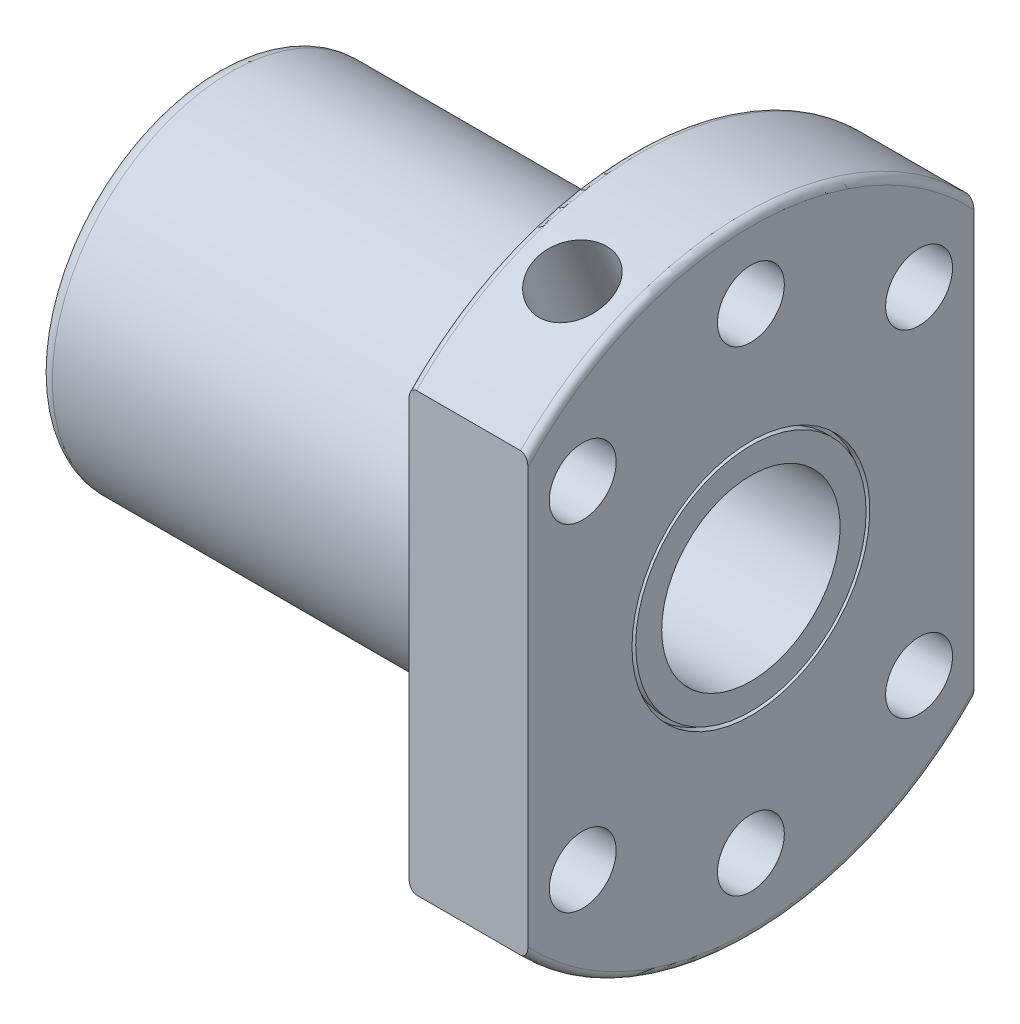
from build123d import *

# Parameters (mm, degrees)
SKETCH2_OUTSIDE_W   = 57.892
SKETCH2_OUTSIDE_H   = 57.892
SKETCH2_OUTSIDE_W_2 = 30
SKETCH2_OUTSIDE_H_2 = 42
CUT_EXTRUDE1_DEPTH  = 10
DIAMETERHOLE1_D     = 4.5
TAP1_REACH          = 56.286
TAP1_BORE_R         = 2.4585


with BuildPart() as part:
    # Sketch1 → Revolve1 (revolve)
    with BuildSketch(Plane.XY, mode=Mode.PRIVATE) as revolve1_sk:
        with BuildLine():
            Line((-28, 8), (-28, 11))
            ThreePointArc((-28, 11), (-27.707106781, 11.707106781), (-27, 12))
            Line((-27, 12), (0, 12))
            Line((0, 12), (0, 20.5))
            ThreePointArc((0, 20.5), (0.146446609, 20.853553391), (0.5, 21))
            Line((0.5, 21), (7.5, 21))
            ThreePointArc((7.5, 21), (7.853553391, 20.853553391), (8, 20.5))
            Line((8, 20.5), (8, 8))
            Line((8, 8), (7.5, 8))
            Line((7.5, 8), (7.5, 7.75))
            Line((7.5, 7.75), (8, 7.75))
            Line((8, 7.75), (8, 6))
            Line((8, 6), (-28, 6))
            Line((-28, 6), (-28, 7.75))
            Line((-28, 7.75), (-27.5, 7.75))
            Line((-27.5, 7.75), (-27.5, 8))
            Line((-27.5, 8), (-28, 8))
        make_face()
    revolve(revolve1_sk.sketch.rotate(Axis((-29.8, 0, 0), (1, 0, 0)), 90), axis=Axis((-29.8, 0, 0), (1, 0, 0)))

    # Sketch2 outside → Cut-Extrude1 (cut)
    with BuildSketch(Plane(origin=(8, 0, 0), x_dir=(0, 0, -1), z_dir=(1, 0, 0))):
        Rectangle(SKETCH2_OUTSIDE_W, SKETCH2_OUTSIDE_H)
        Rectangle(SKETCH2_OUTSIDE_W_2, SKETCH2_OUTSIDE_H_2, mode=Mode.SUBTRACT)
    extrude(amount=-CUT_EXTRUDE1_DEPTH, mode=Mode.SUBTRACT)

    # DiameterHole1 (through all)
    with Locations(Plane(origin=(8, 0, 0), x_dir=(0, 0, -1), z_dir=(1, 0, 0))):
        with Locations((11.313708499, 11.313708499), (0, 16), (-11.313708499, 11.313708499), (-11.313708499, -11.313708499), (0, -16), (11.313708499, -11.313708499)):
            Hole(DIAMETERHOLE1_D / 2)

    # Tap1 bore → Tap1 (cut, up to next)
    with BuildSketch(Plane(origin=(0, 19.401470183, 8.03635208), x_dir=(1, 0, 0), z_dir=(0, 0.9238795325112865, 0.3826834323650906)), mode=Mode.PRIVATE) as tap1_sk1:
        with Locations((4, 0)):
            Circle(TAP1_BORE_R)
    tap1_tool1 = extrude(tap1_sk1.sketch, amount=-TAP1_REACH, mode=Mode.PRIVATE) & part.part
    add(tap1_tool1.solids().sort_by_distance((4, 19.40147, 8.036352))[0], mode=Mode.SUBTRACT)


solid = part.part
